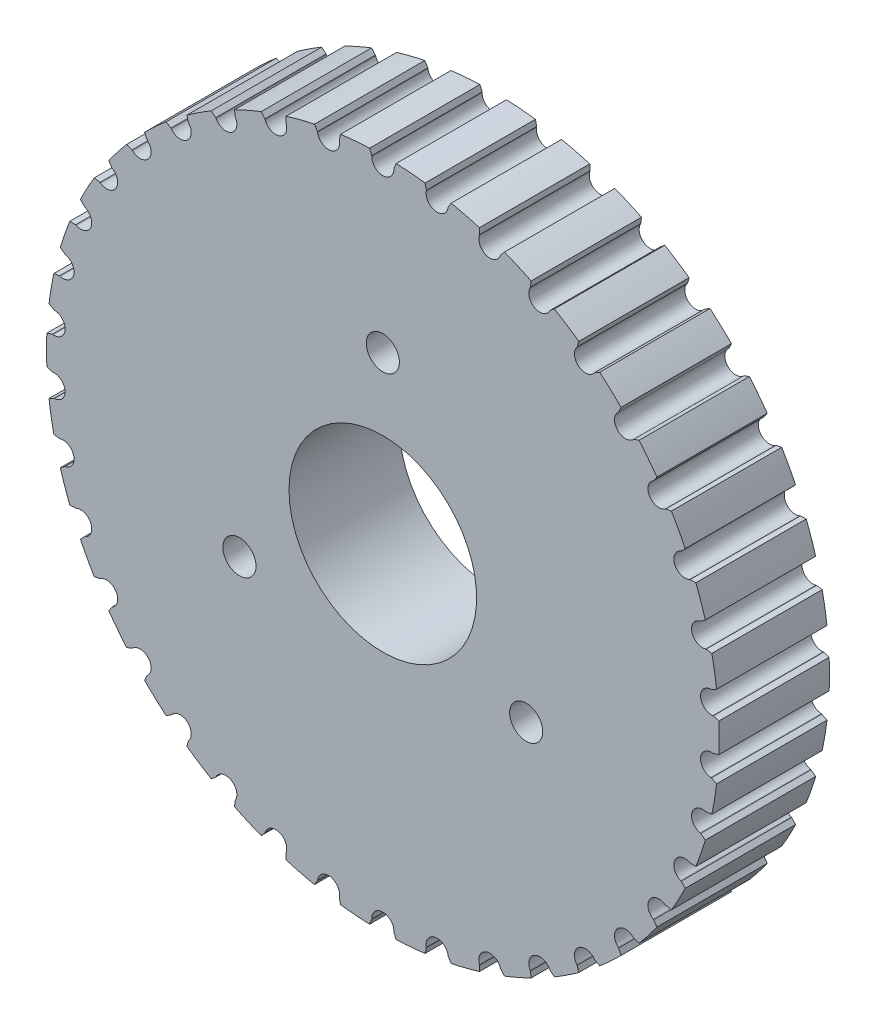
from build123d import *

# Parameters (mm, degrees)
SKETCH_1_R      = 1.5
SKETCH_1_R_2    = 8.5
EXTRUDE_1_DEPTH = 10


with BuildPart() as part:
    # Эскиз1 → Вытянуть1 (new body)
    with BuildSketch(Plane.XY):
        with BuildLine():
            Line((-1, 29.959200332), (-1.2, 30.446361031))
            ThreePointArc((-1.2, 30.446361031), (-2.516192657, 30.365929502), (-3.827672755, 30.228625858))
            Line((-3.827672755, 30.228625858), (-3.944761, 29.715190479))
            Line((-3.944761, 29.715190479), (-3.93342734, 29.647271577))
            ThreePointArc((-3.93342734, 29.647271577), (-4.755194053, 28.496315683), (-5.906149947, 29.318082396))
            Line((-5.906149947, 29.318082396), (-5.917483607, 29.386001298))
            Line((-5.917483607, 29.386001298), (-6.194939883, 29.833598842))
            ThreePointArc((-6.194939883, 29.833598842), (-7.479942793, 29.537626103), (-8.750936576, 29.186332573))
            Line((-8.750936576, 29.186332573), (-8.781919204, 28.660627691))
            Line((-8.781919204, 28.660627691), (-8.759561036, 28.595500573))
            ThreePointArc((-8.759561036, 28.595500573), (-9.380678809, 27.324983862), (-10.65119552, 27.946101635))
            Line((-10.65119552, 27.946101635), (-10.673553687, 28.011228752))
            Line((-10.673553687, 28.011228752), (-11.020897956, 28.407053847))
            ThreePointArc((-11.020897956, 28.407053847), (-12.239659589, 27.903613263), (-13.435497658, 27.347912218))
            Line((-13.435497658, 27.347912218), (-13.379529544, 26.824277692))
            Line((-13.379529544, 26.824277692), (-13.346756742, 26.763718857))
            ThreePointArc((-13.346756742, 26.763718857), (-13.7502831, 25.408297713), (-15.105704244, 25.811824071))
            Line((-15.105704244, 25.811824071), (-15.138477047, 25.872382906))
            Line((-15.138477047, 25.872382906), (-15.546234661, 26.205638474))
            ThreePointArc((-15.546234661, 26.205638474), (-16.665510378, 25.508462593), (-17.753573389, 24.763512108))
            Line((-17.753573389, 24.763512108), (-17.612181196, 24.256231324))
            Line((-17.612181196, 24.256231324), (-17.569887716, 24.201892658))
            ThreePointArc((-17.569887716, 24.201892658), (-17.744815512, 22.798539436), (-19.148168734, 22.973467233))
            Line((-19.148168734, 22.973467233), (-19.190462215, 23.027805898))
            Line((-19.190462215, 23.027805898), (-19.647510611, 23.289401598))
            ThreePointArc((-19.647510611, 23.289401598), (-20.636769487, 22.417507558), (-21.587377917, 21.503627942))
            Line((-21.587377917, 21.503627942), (-21.364418457, 21.026538196))
            Line((-21.364418457, 21.026538196), (-21.313757954, 20.979901917))
            ThreePointArc((-21.313757954, 20.979901917), (-21.255315615, 19.566896435), (-22.668321097, 19.508454096))
            Line((-22.668321097, 19.508454096), (-22.7189816, 19.555090375))
            Line((-22.7189816, 19.555090375), (-23.212853689, 19.737890556))
            ThreePointArc((-23.212853689, 19.737890556), (-24.045111321, 18.715061356), (-24.83233505, 17.657180861))
            Line((-24.83233505, 17.657180861), (-24.533890075, 17.223295919))
            Line((-24.533890075, 17.223295919), (-24.476244436, 17.185634143))
            ThreePointArc((-24.476244436, 17.185634143), (-24.186026116, 15.801519506), (-25.570140752, 15.511301186))
            Line((-25.570140752, 15.511301186), (-25.627786391, 15.548962962))
            Line((-25.627786391, 15.548962962), (-26.14501063, 15.647981313))
            ThreePointArc((-26.14501063, 15.647981313), (-26.797565199, 14.502117066), (-27.399930816, 13.329091915))
            Line((-27.399930816, 13.329091915), (-27.034141127, 12.950247026))
            Line((-27.034141127, 12.950247026), (-26.971082775, 12.922587068))
            ThreePointArc((-26.971082775, 12.922587068), (-26.457004873, 11.605118317), (-27.774473624, 11.091040415))
            Line((-27.774473624, 11.091040415), (-27.837531976, 11.118700373))
            Line((-27.837531976, 11.118700373), (-28.363999835, 11.131235931))
            ThreePointArc((-28.363999835, 11.131235931), (-28.819051355, 9.893592827), (-29.220127895, 8.637420088))
            Line((-29.220127895, 8.637420088), (-28.796971282, 8.323949154))
            Line((-28.796971282, 8.323949154), (-28.730220284, 8.307045505))
            ThreePointArc((-28.730220284, 8.307045505), (-28.006305505, 7.092159752), (-29.221191258, 6.368244973))
            Line((-29.221191258, 6.368244973), (-29.287942256, 6.385148622))
            Line((-29.287942256, 6.385148622), (-29.809293064, 6.31085945))
            ThreePointArc((-29.809293064, 6.31085945), (-30.054428915, 5.015197166), (-30.243276057, 3.710141958))
            Line((-30.243276057, 3.710141958), (-29.774295128, 3.470595647))
            Line((-29.774295128, 3.470595647), (-29.705672278, 3.464909396))
            ThreePointArc((-29.705672278, 3.464909396), (-28.79166713, 2.385745557), (-29.870830968, 1.47174041))
            Line((-29.870830968, 1.47174041), (-29.939453819, 1.477426661))
            Line((-29.939453819, 1.477426661), (-30.441466486, 1.318339174))
            ThreePointArc((-30.441466486, 1.318339174), (-30.47, 0), (-30.441466486, -1.318339174))
            Line((-30.441466486, -1.318339174), (-29.939453819, -1.477426661))
            Line((-29.939453819, -1.477426661), (-29.870830968, -1.47174041))
            ThreePointArc((-29.870830968, -1.47174041), (-28.79166713, -2.385745557), (-29.705672278, -3.464909396))
            Line((-29.705672278, -3.464909396), (-29.774295128, -3.470595647))
            Line((-29.774295128, -3.470595647), (-30.243276057, -3.710141958))
            ThreePointArc((-30.243276057, -3.710141958), (-30.054428915, -5.015197166), (-29.809293064, -6.31085945))
            Line((-29.809293064, -6.31085945), (-29.287942256, -6.385148622))
            Line((-29.287942256, -6.385148622), (-29.221191258, -6.368244973))
            ThreePointArc((-29.221191258, -6.368244973), (-28.006305505, -7.092159752), (-28.730220284, -8.307045505))
            Line((-28.730220284, -8.307045505), (-28.796971282, -8.323949154))
            Line((-28.796971282, -8.323949154), (-29.220127895, -8.637420088))
            ThreePointArc((-29.220127895, -8.637420088), (-28.819051355, -9.893592827), (-28.363999835, -11.131235931))
            Line((-28.363999835, -11.131235931), (-27.837531976, -11.118700373))
            Line((-27.837531976, -11.118700373), (-27.774473624, -11.091040415))
            ThreePointArc((-27.774473624, -11.091040415), (-26.457004873, -11.605118317), (-26.971082775, -12.922587068))
            Line((-26.971082775, -12.922587068), (-27.034141127, -12.950247026))
            Line((-27.034141127, -12.950247026), (-27.399930816, -13.329091915))
            ThreePointArc((-27.399930816, -13.329091915), (-26.797565199, -14.502117066), (-26.14501063, -15.647981313))
            Line((-26.14501063, -15.647981313), (-25.627786391, -15.548962962))
            Line((-25.627786391, -15.548962962), (-25.570140752, -15.511301186))
            ThreePointArc((-25.570140752, -15.511301186), (-24.186026116, -15.801519506), (-24.476244436, -17.185634143))
            Line((-24.476244436, -17.185634143), (-24.533890075, -17.223295919))
            Line((-24.533890075, -17.223295919), (-24.83233505, -17.657180861))
            ThreePointArc((-24.83233505, -17.657180861), (-24.045111321, -18.715061356), (-23.212853689, -19.737890556))
            Line((-23.212853689, -19.737890556), (-22.7189816, -19.555090375))
            Line((-22.7189816, -19.555090375), (-22.668321097, -19.508454096))
            ThreePointArc((-22.668321097, -19.508454096), (-21.255315615, -19.566896435), (-21.313757954, -20.979901917))
            Line((-21.313757954, -20.979901917), (-21.364418457, -21.026538196))
            Line((-21.364418457, -21.026538196), (-21.587377917, -21.503627942))
            ThreePointArc((-21.587377917, -21.503627942), (-20.636769487, -22.417507558), (-19.647510611, -23.289401598))
            Line((-19.647510611, -23.289401598), (-19.190462215, -23.027805898))
            Line((-19.190462215, -23.027805898), (-19.148168734, -22.973467233))
            ThreePointArc((-19.148168734, -22.973467233), (-17.744815512, -22.798539436), (-17.569887716, -24.201892658))
            Line((-17.569887716, -24.201892658), (-17.612181196, -24.256231324))
            Line((-17.612181196, -24.256231324), (-17.753573389, -24.763512108))
            ThreePointArc((-17.753573389, -24.763512108), (-16.665510378, -25.508462593), (-15.546234661, -26.205638474))
            Line((-15.546234661, -26.205638474), (-15.138477047, -25.872382906))
            Line((-15.138477047, -25.872382906), (-15.105704244, -25.811824071))
            ThreePointArc((-15.105704244, -25.811824071), (-13.7502831, -25.408297713), (-13.346756742, -26.763718857))
            Line((-13.346756742, -26.763718857), (-13.379529544, -26.824277692))
            Line((-13.379529544, -26.824277692), (-13.435497658, -27.347912218))
            ThreePointArc((-13.435497658, -27.347912218), (-12.239659589, -27.903613263), (-11.020897956, -28.407053847))
            Line((-11.020897956, -28.407053847), (-10.673553687, -28.011228752))
            Line((-10.673553687, -28.011228752), (-10.65119552, -27.946101635))
            ThreePointArc((-10.65119552, -27.946101635), (-9.380678809, -27.324983862), (-8.759561036, -28.595500573))
            Line((-8.759561036, -28.595500573), (-8.781919204, -28.660627691))
            Line((-8.781919204, -28.660627691), (-8.750936576, -29.186332573))
            ThreePointArc((-8.750936576, -29.186332573), (-7.479942793, -29.537626103), (-6.194939883, -29.833598842))
            Line((-6.194939883, -29.833598842), (-5.917483607, -29.386001298))
            Line((-5.917483607, -29.386001298), (-5.906149947, -29.318082396))
            ThreePointArc((-5.906149947, -29.318082396), (-4.755194053, -28.496315683), (-3.93342734, -29.647271577))
            Line((-3.93342734, -29.647271577), (-3.944761, -29.715190478))
            Line((-3.944761, -29.715190478), (-3.827672755, -30.228625858))
            ThreePointArc((-3.827672755, -30.228625858), (-2.516192657, -30.365929502), (-1.2, -30.446361031))
            Line((-1.2, -30.446361031), (-1, -29.959200332))
            Line((-1, -29.959200332), (-1, -29.890342296))
            ThreePointArc((-1, -29.890342296), (0, -28.890342296), (1, -29.890342296))
            Line((1, -29.890342296), (1, -29.959200332))
            Line((1, -29.959200332), (1.2, -30.446361031))
            ThreePointArc((1.2, -30.446361031), (2.516192657, -30.365929502), (3.827672755, -30.228625858))
            Line((3.827672755, -30.228625858), (3.944761, -29.715190478))
            Line((3.944761, -29.715190478), (3.93342734, -29.647271577))
            ThreePointArc((3.93342734, -29.647271577), (4.755194053, -28.496315683), (5.906149947, -29.318082396))
            Line((5.906149947, -29.318082396), (5.917483607, -29.386001298))
            Line((5.917483607, -29.386001298), (6.194939883, -29.833598842))
            ThreePointArc((6.194939883, -29.833598842), (7.479942793, -29.537626103), (8.750936576, -29.186332573))
            Line((8.750936576, -29.186332573), (8.781919204, -28.660627691))
            Line((8.781919204, -28.660627691), (8.759561036, -28.595500573))
            ThreePointArc((8.759561036, -28.595500573), (9.380678809, -27.324983862), (10.65119552, -27.946101635))
            Line((10.65119552, -27.946101635), (10.673553687, -28.011228752))
            Line((10.673553687, -28.011228752), (11.020897956, -28.407053847))
            ThreePointArc((11.020897956, -28.407053847), (12.239659589, -27.903613263), (13.435497658, -27.347912218))
            Line((13.435497658, -27.347912218), (13.379529544, -26.824277692))
            Line((13.379529544, -26.824277692), (13.346756742, -26.763718857))
            ThreePointArc((13.346756742, -26.763718857), (13.7502831, -25.408297713), (15.105704244, -25.811824071))
            Line((15.105704244, -25.811824071), (15.138477047, -25.872382906))
            Line((15.138477047, -25.872382906), (15.546234661, -26.205638474))
            ThreePointArc((15.546234661, -26.205638474), (16.665510378, -25.508462593), (17.753573389, -24.763512108))
            Line((17.753573389, -24.763512108), (17.612181196, -24.256231324))
            Line((17.612181196, -24.256231324), (17.569887716, -24.201892658))
            ThreePointArc((17.569887716, -24.201892658), (17.744815512, -22.798539436), (19.148168734, -22.973467233))
            Line((19.148168734, -22.973467233), (19.190462215, -23.027805898))
            Line((19.190462215, -23.027805898), (19.647510611, -23.289401598))
            ThreePointArc((19.647510611, -23.289401598), (20.636769487, -22.417507558), (21.587377917, -21.503627942))
            Line((21.587377917, -21.503627942), (21.364418457, -21.026538196))
            Line((21.364418457, -21.026538196), (21.313757954, -20.979901917))
            ThreePointArc((21.313757954, -20.979901917), (21.255315615, -19.566896435), (22.668321097, -19.508454096))
            Line((22.668321097, -19.508454096), (22.7189816, -19.555090375))
            Line((22.7189816, -19.555090375), (23.212853689, -19.737890556))
            ThreePointArc((23.212853689, -19.737890556), (24.045111321, -18.715061356), (24.83233505, -17.657180861))
            Line((24.83233505, -17.657180861), (24.533890075, -17.223295919))
            Line((24.533890075, -17.223295919), (24.476244436, -17.185634143))
            ThreePointArc((24.476244436, -17.185634143), (24.186026116, -15.801519506), (25.570140752, -15.511301186))
            Line((25.570140752, -15.511301186), (25.627786391, -15.548962962))
            Line((25.627786391, -15.548962962), (26.14501063, -15.647981313))
            ThreePointArc((26.14501063, -15.647981313), (26.797565199, -14.502117066), (27.399930816, -13.329091915))
            Line((27.399930816, -13.329091915), (27.034141127, -12.950247026))
            Line((27.034141127, -12.950247026), (26.971082775, -12.922587068))
            ThreePointArc((26.971082775, -12.922587068), (26.457004873, -11.605118317), (27.774473624, -11.091040415))
            Line((27.774473624, -11.091040415), (27.837531976, -11.118700373))
            Line((27.837531976, -11.118700373), (28.363999835, -11.131235931))
            ThreePointArc((28.363999835, -11.131235931), (28.819051355, -9.893592827), (29.220127895, -8.637420088))
            Line((29.220127895, -8.637420088), (28.796971282, -8.323949154))
            Line((28.796971282, -8.323949154), (28.730220284, -8.307045505))
            ThreePointArc((28.730220284, -8.307045505), (28.006305505, -7.092159752), (29.221191258, -6.368244973))
            Line((29.221191258, -6.368244973), (29.287942256, -6.385148622))
            Line((29.287942256, -6.385148622), (29.809293064, -6.31085945))
            ThreePointArc((29.809293064, -6.31085945), (30.054428915, -5.015197166), (30.243276057, -3.710141958))
            Line((30.243276057, -3.710141958), (29.774295128, -3.470595647))
            Line((29.774295128, -3.470595647), (29.705672278, -3.464909396))
            ThreePointArc((29.705672278, -3.464909396), (28.79166713, -2.385745557), (29.870830968, -1.47174041))
            Line((29.870830968, -1.47174041), (29.939453819, -1.477426661))
            Line((29.939453819, -1.477426661), (30.441466486, -1.318339174))
            ThreePointArc((30.441466486, -1.318339174), (30.47, 0), (30.441466486, 1.318339174))
            Line((30.441466486, 1.318339174), (29.939453819, 1.477426661))
            Line((29.939453819, 1.477426661), (29.870830968, 1.47174041))
            ThreePointArc((29.870830968, 1.47174041), (28.79166713, 2.385745557), (29.705672278, 3.464909396))
            Line((29.705672278, 3.464909396), (29.774295128, 3.470595647))
            Line((29.774295128, 3.470595647), (30.243276057, 3.710141958))
            ThreePointArc((30.243276057, 3.710141958), (30.054428915, 5.015197166), (29.809293064, 6.31085945))
            Line((29.809293064, 6.31085945), (29.287942256, 6.385148622))
            Line((29.287942256, 6.385148622), (29.221191258, 6.368244973))
            ThreePointArc((29.221191258, 6.368244973), (28.006305505, 7.092159752), (28.730220284, 8.307045505))
            Line((28.730220284, 8.307045505), (28.796971282, 8.323949154))
            Line((28.796971282, 8.323949154), (29.220127895, 8.637420088))
            ThreePointArc((29.220127895, 8.637420088), (28.819051355, 9.893592827), (28.363999835, 11.131235931))
            Line((28.363999835, 11.131235931), (27.837531976, 11.118700373))
            Line((27.837531976, 11.118700373), (27.774473624, 11.091040415))
            ThreePointArc((27.774473624, 11.091040415), (26.457004873, 11.605118317), (26.971082775, 12.922587068))
            Line((26.971082775, 12.922587068), (27.034141127, 12.950247026))
            Line((27.034141127, 12.950247026), (27.399930816, 13.329091915))
            ThreePointArc((27.399930816, 13.329091915), (26.797565199, 14.502117066), (26.14501063, 15.647981313))
            Line((26.14501063, 15.647981313), (25.627786391, 15.548962962))
            Line((25.627786391, 15.548962962), (25.570140752, 15.511301186))
            ThreePointArc((25.570140752, 15.511301186), (24.186026116, 15.801519506), (24.476244436, 17.185634143))
            Line((24.476244436, 17.185634143), (24.533890075, 17.223295919))
            Line((24.533890075, 17.223295919), (24.83233505, 17.657180861))
            ThreePointArc((24.83233505, 17.657180861), (24.045111321, 18.715061356), (23.212853689, 19.737890556))
            Line((23.212853689, 19.737890556), (22.7189816, 19.555090375))
            Line((22.7189816, 19.555090375), (22.668321097, 19.508454096))
            ThreePointArc((22.668321097, 19.508454096), (21.255315615, 19.566896435), (21.313757954, 20.979901917))
            Line((21.313757954, 20.979901917), (21.364418457, 21.026538196))
            Line((21.364418457, 21.026538196), (21.587377917, 21.503627942))
            ThreePointArc((21.587377917, 21.503627942), (20.636769487, 22.417507558), (19.647510611, 23.289401598))
            Line((19.647510611, 23.289401598), (19.190462215, 23.027805898))
            Line((19.190462215, 23.027805898), (19.148168734, 22.973467233))
            ThreePointArc((19.148168734, 22.973467233), (17.744815512, 22.798539436), (17.569887716, 24.201892658))
            Line((17.569887716, 24.201892658), (17.612181196, 24.256231324))
            Line((17.612181196, 24.256231324), (17.753573389, 24.763512108))
            ThreePointArc((17.753573389, 24.763512108), (16.665510378, 25.508462593), (15.546234661, 26.205638474))
            Line((15.546234661, 26.205638474), (15.138477047, 25.872382906))
            Line((15.138477047, 25.872382906), (15.105704244, 25.811824071))
            ThreePointArc((15.105704244, 25.811824071), (13.7502831, 25.408297713), (13.346756742, 26.763718857))
            Line((13.346756742, 26.763718857), (13.379529544, 26.824277692))
            Line((13.379529544, 26.824277692), (13.435497658, 27.347912218))
            ThreePointArc((13.435497658, 27.347912218), (12.239659589, 27.903613263), (11.020897956, 28.407053847))
            Line((11.020897956, 28.407053847), (10.673553687, 28.011228752))
            Line((10.673553687, 28.011228752), (10.65119552, 27.946101635))
            ThreePointArc((10.65119552, 27.946101635), (9.380678809, 27.324983862), (8.759561036, 28.595500573))
            Line((8.759561036, 28.595500573), (8.781919204, 28.660627691))
            Line((8.781919204, 28.660627691), (8.750936576, 29.186332573))
            ThreePointArc((8.750936576, 29.186332573), (7.479942793, 29.537626103), (6.194939883, 29.833598842))
            Line((6.194939883, 29.833598842), (5.917483607, 29.386001298))
            Line((5.917483607, 29.386001298), (5.906149947, 29.318082396))
            ThreePointArc((5.906149947, 29.318082396), (4.755194053, 28.496315683), (3.93342734, 29.647271577))
            Line((3.93342734, 29.647271577), (3.944761, 29.715190478))
            Line((3.944761, 29.715190478), (3.827672755, 30.228625858))
            ThreePointArc((3.827672755, 30.228625858), (2.516192657, 30.365929502), (1.2, 30.446361031))
            Line((1.2, 30.446361031), (1, 29.959200332))
            Line((1, 29.959200332), (1, 29.890342296))
            ThreePointArc((1, 29.890342296), (0, 28.890342296), (-1, 29.890342296))
            Line((-1, 29.890342296), (-1, 29.959200332))
        make_face()
        with Locations(Location((-12.990381057, -7.5, 0), (0, 0, 180))):
            Circle(SKETCH_1_R, mode=Mode.SUBTRACT)
        with Locations(Location((12.990381057, -7.5, 0), (0, 0, 180))):
            Circle(SKETCH_1_R, mode=Mode.SUBTRACT)
        with Locations(Location((0, 0, 0), (0, 0, 180))):
            Circle(SKETCH_1_R_2, mode=Mode.SUBTRACT)
        with Locations(Location((0, 15, 0), (0, 0, 180))):
            Circle(SKETCH_1_R, mode=Mode.SUBTRACT)
    extrude(amount=EXTRUDE_1_DEPTH)


solid = part.part
